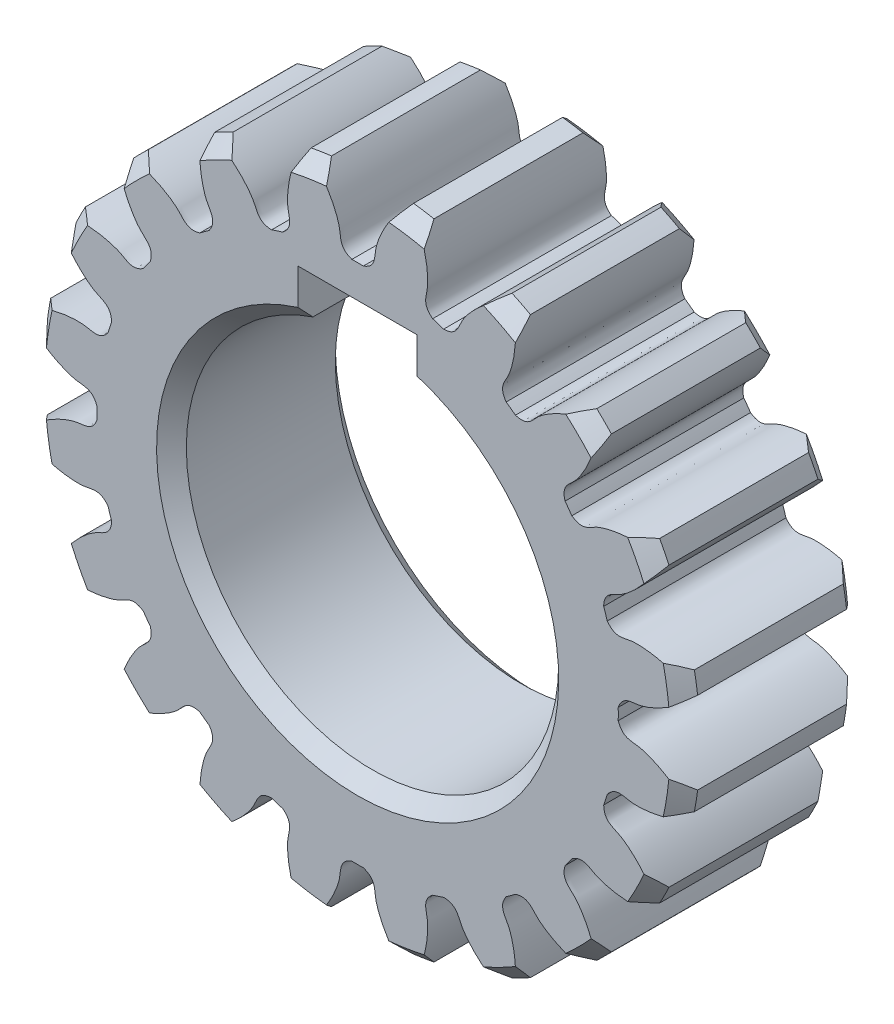
from build123d import *

# Parameters (mm, degrees)
SKETCH_1_R               = 22
EXTRUDE_1_DEPTH          = 12
CHAMFER_1_SIZE           = 1
CUT_EXTRUDE_1_DEPTH      = 34.346664001
PATTERN_CIRCULAR_1_COUNT = 20
CUT_EXTRUDE_2_DEPTH      = 34.118206967
CHAMFER_2_SIZE           = 1
CHAMFER_3_SIZE           = 1


with BuildPart() as part:
    # 草图1 → 凸台-拉伸1 (new body)
    with BuildSketch(Plane.XY):
        Circle(SKETCH_1_R)
    extrude(amount=EXTRUDE_1_DEPTH)

    # 倒角1
    chamfer_1_edges = [part.edges().sort_by_distance(p)[0] for p in [
        (-22, 0, 0),
        (-22, 0, 12),
    ]]
    chamfer(chamfer_1_edges, length=CHAMFER_1_SIZE)

    # 草图2 → 切除-拉伸1 (cut, through all)
    with BuildSketch(Plane.XY):
        with BuildLine():
            ThreePointArc((0.386633201, 17.495728472), (0, 17.5), (-0.386633201, 17.495728472))
            add(Edge.make_bspline(
                [(-0.386633201, 17.495728472), (-1.22237881, 17.786951024), (-1.114168199, 18.374227398), (-1.225794113, 18.940018805), (-1.237784373, 18.995113228), (-1.25262178, 19.05726923), (-1.270584194, 19.126393672), (-1.29195828, 19.202382994), (-1.31702411, 19.285125656), (-1.346059743, 19.374501466), (-1.3793395, 19.470381894), (-1.4171342, 19.57263009), (-1.459710797, 19.681101001), (-1.507332204, 19.795641461), (-1.560257063, 19.916090303), (-1.618739529, 20.042278463), (-1.683029067, 20.174029102), (-1.753370234, 20.311157723), (-1.830002477, 20.4534723), (-1.913159931, 20.600773408), (-2.003071219, 20.752854362), (-2.099959252, 20.909501356), (-2.204041043, 21.070493611), (-2.315527511, 21.235603527), (-2.434623302, 21.404596841), (-2.561526601, 21.577232781), (-2.696428961, 21.753264241), (-2.839515123, 21.932437945), (-2.990962853, 22.114494623), (-3.15094277, 22.299169189), (-3.319618193, 22.486190926), (-3.497144978, 22.67528367), (-3.683671369, 22.866166005), (-3.879337852, 23.058551454), (-4.084277013, 23.252148679), (-4.298613397, 23.446661685), (-4.522463379, 23.641790022), (-4.755935037, 23.837228999), (-4.999128023, 24.032669892), (-5.252133469, 24.227800163), (-5.515033799, 24.42230368), (-5.882947182, 24.683279735), (-6.167864825, 24.872665202), (-6.362315964, 24.996503719)],
                knots=[0, 0, 0, 0, 0.165916003, 0.170905922, 0.176663519, 0.183188797, 0.190481754, 0.198542391, 0.207370708, 0.216966704, 0.22733038, 0.238461736, 0.250360771, 0.263027487, 0.276461881, 0.290663956, 0.30563371, 0.321371144, 0.337876258, 0.355149051, 0.373189524, 0.391997677, 0.411573509, 0.431917021, 0.453028213, 0.474907084, 0.497553636, 0.520967867, 0.545149777, 0.570099367, 0.595816637, 0.622301587, 0.649554216, 0.677574526, 0.706362514, 0.735918183, 0.766241531, 0.797332559, 0.829191267, 0.861817654, 0.895211721, 0.929373468, 1, 1, 1, 1], degree=3))
            ThreePointArc((-6.362315964, 24.996503719), (0, 25.793492641), (6.362315964, 24.996503719))
            add(Edge.make_bspline(
                [(0.386633201, 17.495728472), (1.22237881, 17.786951024), (1.114168199, 18.374227398), (1.225794113, 18.940018805), (1.237784373, 18.995113228), (1.25262178, 19.05726923), (1.270584194, 19.126393672), (1.29195828, 19.202382994), (1.31702411, 19.285125656), (1.346059743, 19.374501466), (1.3793395, 19.470381894), (1.4171342, 19.57263009), (1.459710797, 19.681101001), (1.507332204, 19.795641461), (1.560257063, 19.916090303), (1.618739529, 20.042278463), (1.683029067, 20.174029102), (1.753370234, 20.311157723), (1.830002477, 20.4534723), (1.913159931, 20.600773408), (2.003071219, 20.752854362), (2.099959252, 20.909501356), (2.204041043, 21.070493611), (2.315527511, 21.235603527), (2.434623302, 21.404596841), (2.561526601, 21.577232781), (2.696428961, 21.753264241), (2.839515123, 21.932437945), (2.990962853, 22.114494623), (3.15094277, 22.299169189), (3.319618193, 22.486190926), (3.497144978, 22.67528367), (3.683671369, 22.866166005), (3.879337852, 23.058551454), (4.084277013, 23.252148679), (4.298613397, 23.446661685), (4.522463379, 23.641790022), (4.755935037, 23.837228999), (4.999128023, 24.032669892), (5.252133469, 24.227800163), (5.515033799, 24.42230368), (5.882947182, 24.683279735), (6.167864825, 24.872665202), (6.362315964, 24.996503719)],
                knots=[0, 0, 0, 0, 0.165916003, 0.170905922, 0.176663519, 0.183188797, 0.190481754, 0.198542391, 0.207370708, 0.216966704, 0.22733038, 0.238461736, 0.250360771, 0.263027487, 0.276461881, 0.290663956, 0.30563371, 0.321371144, 0.337876258, 0.355149051, 0.373189524, 0.391997677, 0.411573509, 0.431917021, 0.453028213, 0.474907084, 0.497553636, 0.520967867, 0.545149777, 0.570099367, 0.595816637, 0.622301587, 0.649554216, 0.677574526, 0.706362514, 0.735918183, 0.766241531, 0.797332559, 0.829191267, 0.861817654, 0.895211721, 0.929373468, 1, 1, 1, 1], degree=3))
        make_face()
    cut_extrude_1 = extrude(amount=CUT_EXTRUDE_1_DEPTH, mode=Mode.SUBTRACT)

    # 阵列(圆周)1: 切除-拉伸1 ×20 about axis
    pattern_circular_1_axis = Axis((0, 0, -0.6), (0, 0, 1))
    for i in range(1, PATTERN_CIRCULAR_1_COUNT):
        add(cut_extrude_1.rotate(pattern_circular_1_axis, i * 360 / PATTERN_CIRCULAR_1_COUNT), mode=Mode.SUBTRACT)

    # 草图4 → 切除-拉伸2 (cut, through all)
    with BuildSketch(Plane.XY):
        with BuildLine():
            Line((-4, 15.3), (4, 15.3))
            Line((4, 15.3), (4, 11.842719282))
            ThreePointArc((4, 11.842719282), (0, -12.5), (-4, 11.842719282))
            Line((-4, 11.842719282), (-4, 15.3))
        make_face()
    extrude(amount=CUT_EXTRUDE_2_DEPTH, mode=Mode.SUBTRACT)

    # 倒角2
    chamfer_2_edges = [part.edges().sort_by_distance(p)[0] for p in [
        (0, -12.5, 12),
    ]]
    chamfer(chamfer_2_edges, length=CHAMFER_2_SIZE)

    # 倒角3
    chamfer_3_edges = [part.edges().sort_by_distance(p)[0] for p in [
        (0, -12.5, 0),
    ]]
    chamfer(chamfer_3_edges, length=CHAMFER_3_SIZE)


solid = part.part
